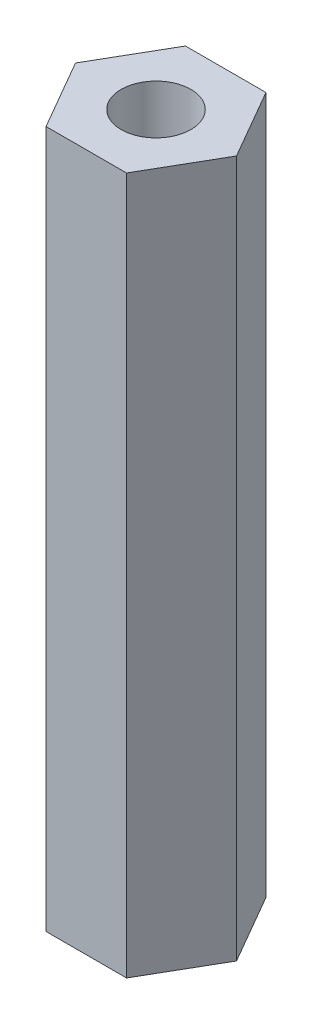
from build123d import *

# Parameters (mm, degrees)
SKETCH1_R           = 1.5
BOSS_EXTRUDE1_DEPTH = 30


with BuildPart() as part:
    # Sketch1 → Boss-Extrude1 (new body)
    with BuildSketch(Plane(origin=(0, 0, 0), x_dir=(1, 0, 0), z_dir=(0, 1, 0))):
        Polygon((1.732050808, 3), (-1.732050808, 3), (-3.464101615, 0), (-1.732050808, -3), (1.732050808, -3), (3.464101615, 0), align=None)
        with Locations(Location((0, 0, 0), (0, 0, 270))):
            Circle(SKETCH1_R, mode=Mode.SUBTRACT)
    extrude(amount=BOSS_EXTRUDE1_DEPTH)


solid = part.part
